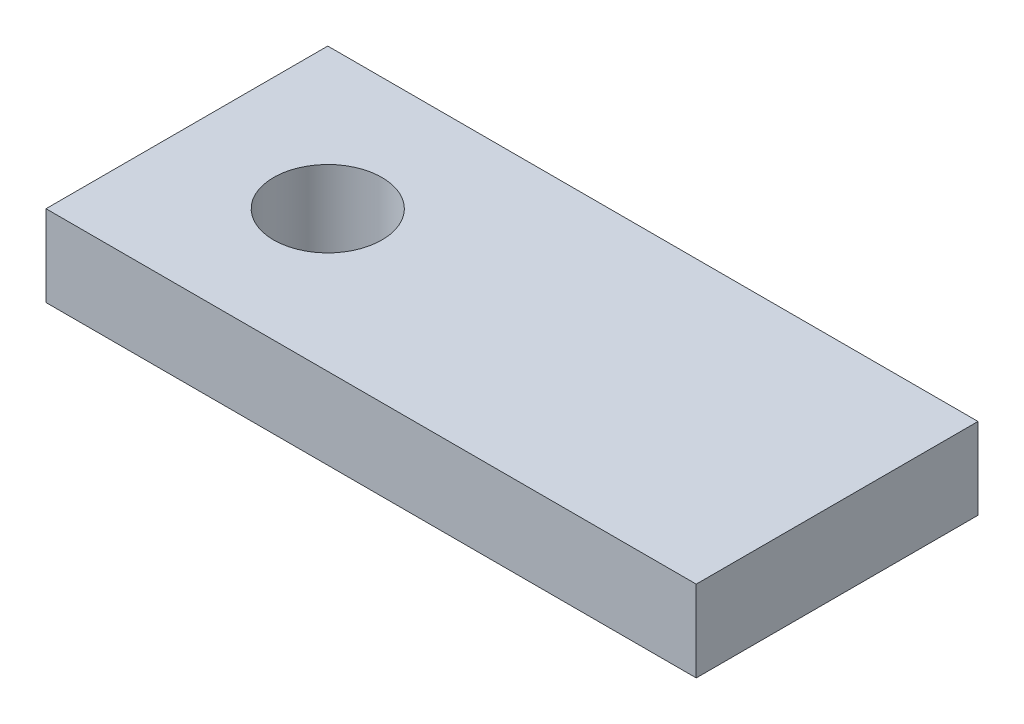
from build123d import *

# Parameters (mm, degrees)
SKETCH1_W           = 12
SKETCH1_H           = 5.2
SKETCH1_R           = 1
BOSS_EXTRUDE1_DEPTH = 1.5


with BuildPart() as part:
    # Sketch1 → Boss-Extrude1 (new body)
    with BuildSketch(Plane(origin=(0, 0, 0), x_dir=(1, 0, 0), z_dir=(0, 1, 0))):
        with Locations((3.4, 0)):
            Rectangle(SKETCH1_W, SKETCH1_H)
        with Locations(Location((0, 0, 0), (0, 0, 270))):
            Circle(SKETCH1_R, mode=Mode.SUBTRACT)
    extrude(amount=BOSS_EXTRUDE1_DEPTH)


solid = part.part
